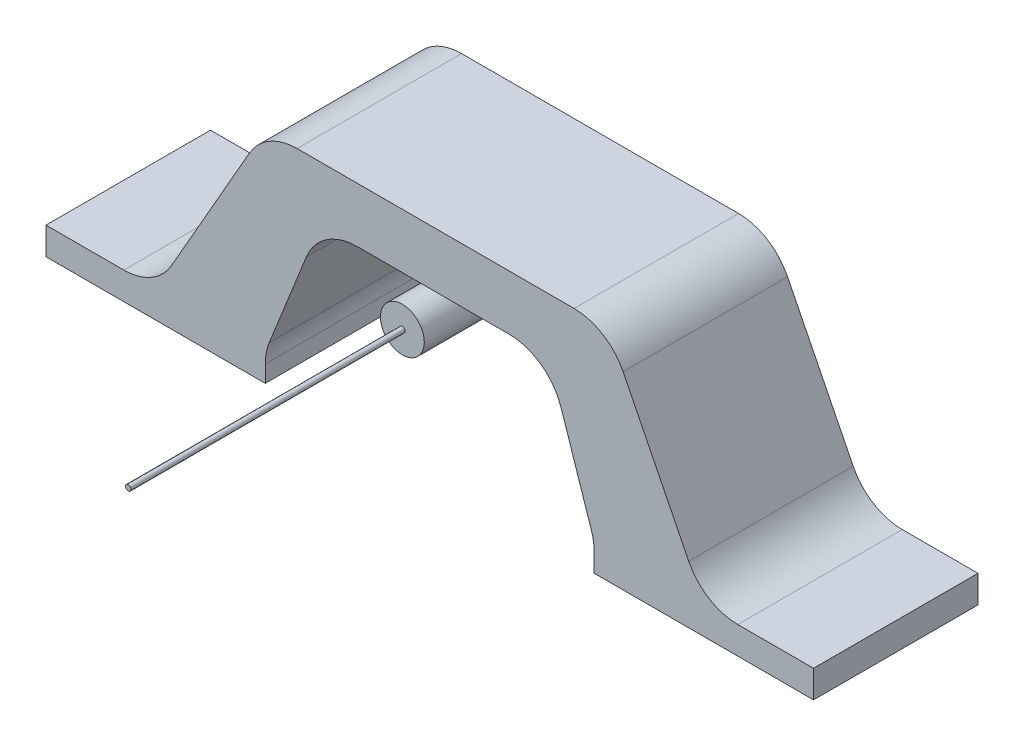
from build123d import *

# Parameters (mm, degrees)
SZKIC1_W                      = 40
SZKIC1_H                      = 5
DODANIE_WYCI_GNI_CIE1_DEPTH   = 30
DODANIE_WYCI_GNI_CIE1_2_DEPTH = 30
DODANIE_WYCI_GNI_CIE2_DEPTH   = 30
ZAOKR_GLENIE1_R               = 10
SZKIC3_R                      = 4
DODANIE_WYCI_GNI_CIE3_DEPTH   = 35
SZKIC4_R                      = 0.5
DODANIE_WYCI_GNI_CIE4_DEPTH   = 50


with BuildPart() as part:
    # Szkic1 → Dodanie-wyciągnięcie1 (new body)
    with BuildSketch(Plane.XY):
        with Locations((-50, 2.5)):
            Rectangle(SZKIC1_W, SZKIC1_H)
    extrude(amount=DODANIE_WYCI_GNI_CIE1_DEPTH)



with BuildPart() as body_2:
    # Szkic1 → Dodanie-wyci_gni_cie1 2 (new body)
    with BuildSketch(Plane.XY):
        with Locations((50, 2.5)):
            Rectangle(SZKIC1_W, SZKIC1_H)
    extrude(amount=DODANIE_WYCI_GNI_CIE1_2_DEPTH)


with BuildPart() as part_1:
    add(part.part)

    add(body_2.part)  # Dodanie-wyciągnięcie2 merges body 2
    # Szkic2 → Dodanie-wyciągnięcie2 (add)
    with BuildSketch(Plane.XY):
        Polygon((-30, 5), (-20, 30), (21.666666667, 30), (30, 5), (50, 5), (32.5, 40), (-30, 40), (-50, 5), align=None)
    extrude(amount=DODANIE_WYCI_GNI_CIE2_DEPTH)

    # Zaokrąglenie1
    zaokr_glenie1_edges = [part_1.edges().sort_by_distance(p)[0] for p in [
        (-50, 5, 15),
        (-20, 30, 15),
        (21.666666667, 30, 15),
        (30, 5, 15),
        (50, 5, 15),
        (32.5, 40, 15),
        (-30, 40, 15),
        (-30, 5, 15),
    ]]
    fillet(zaokr_glenie1_edges, radius=ZAOKR_GLENIE1_R)


with BuildPart() as body_2_2:
    # Szkic3 → Dodanie-wyciągnięcie3 (new body)
    with BuildSketch(Plane.XY):
        with Locations((0, 26)):
            Circle(SZKIC3_R)
    extrude(amount=DODANIE_WYCI_GNI_CIE3_DEPTH)

    # Szkic4 → Dodanie-wyciągnięcie4 (add)
    with BuildSketch(Plane.XY.offset(35)):
        with Locations((0, 26)):
            Circle(SZKIC4_R)
    extrude(amount=DODANIE_WYCI_GNI_CIE4_DEPTH)


solid = Compound([part_1.part, body_2_2.part])
